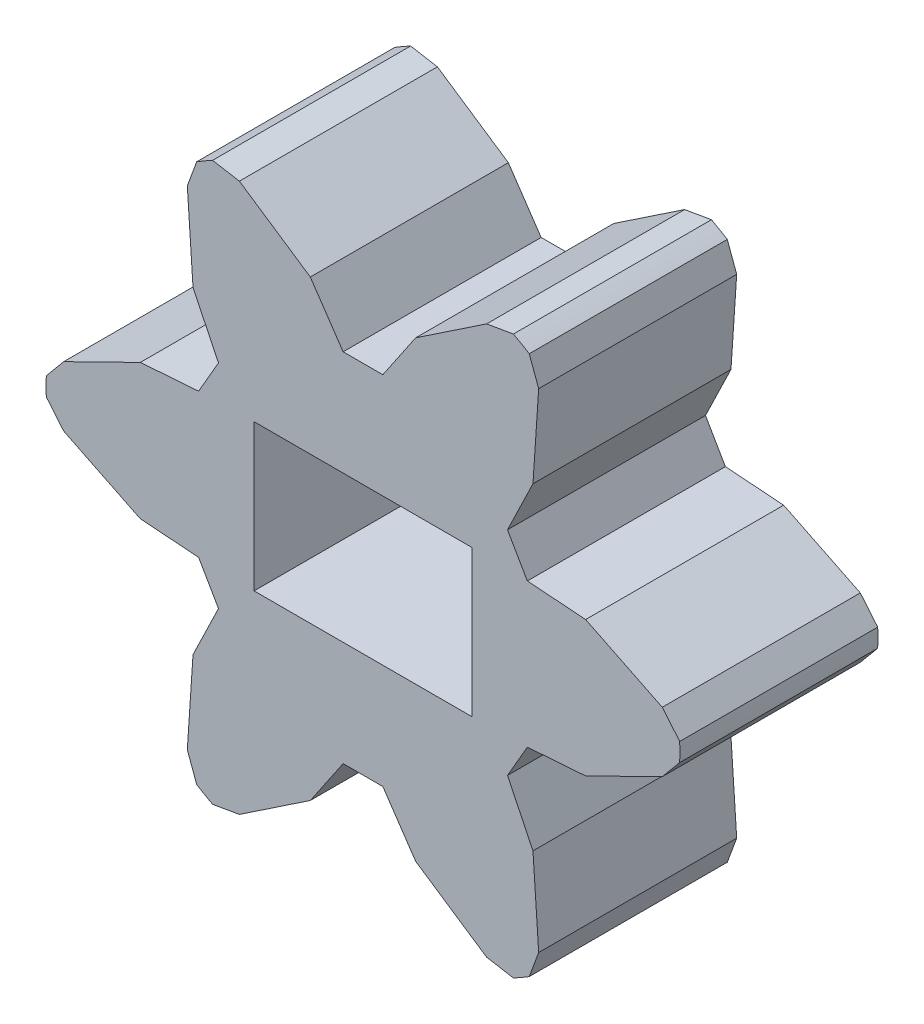
from build123d import *

# Parameters (mm, degrees)
SKETCH1_R           = 8
SKETCH1_W           = 5.5
SKETCH1_H           = 3.7
BOSS_EXTRUDE1_DEPTH = 5
CUT_EXTRUDE1_DEPTH  = 13.369316877
CIRPATTERN1_COUNT   = 6


with BuildPart() as part:
    # Sketch1 → Boss-Extrude1 (new body)
    with BuildSketch(Plane.XY):
        Circle(SKETCH1_R)
        Rectangle(SKETCH1_W, SKETCH1_H, mode=Mode.SUBTRACT)
    extrude(amount=BOSS_EXTRUDE1_DEPTH)

    # Sketch2 → Cut-Extrude1 (cut, through all)
    with BuildSketch(Plane.XY):
        Polygon((-7.331932906, 22.221764399), (0, 24.952212466), (7.331932906, 22.221764399), (3.798424573, 7.040736522), (3.120998591, 6.924019842), (1.330058439, 5.723612136), (0.501497444, 4.50257488), (-0.501497444, 4.50257488), (-1.330058439, 5.723612136), (-3.120998591, 6.924019842), (-3.798424573, 7.040736522), align=None)
    cut_extrude1 = extrude(amount=CUT_EXTRUDE1_DEPTH, mode=Mode.SUBTRACT)

    # CirPattern1: Cut-Extrude1 ×6 about axis
    cirpattern1_axis = Axis((0, 0, 0), (0, 0, 1))
    for i in range(1, CIRPATTERN1_COUNT):
        add(cut_extrude1.rotate(cirpattern1_axis, i * 360 / CIRPATTERN1_COUNT), mode=Mode.SUBTRACT)


solid = part.part
